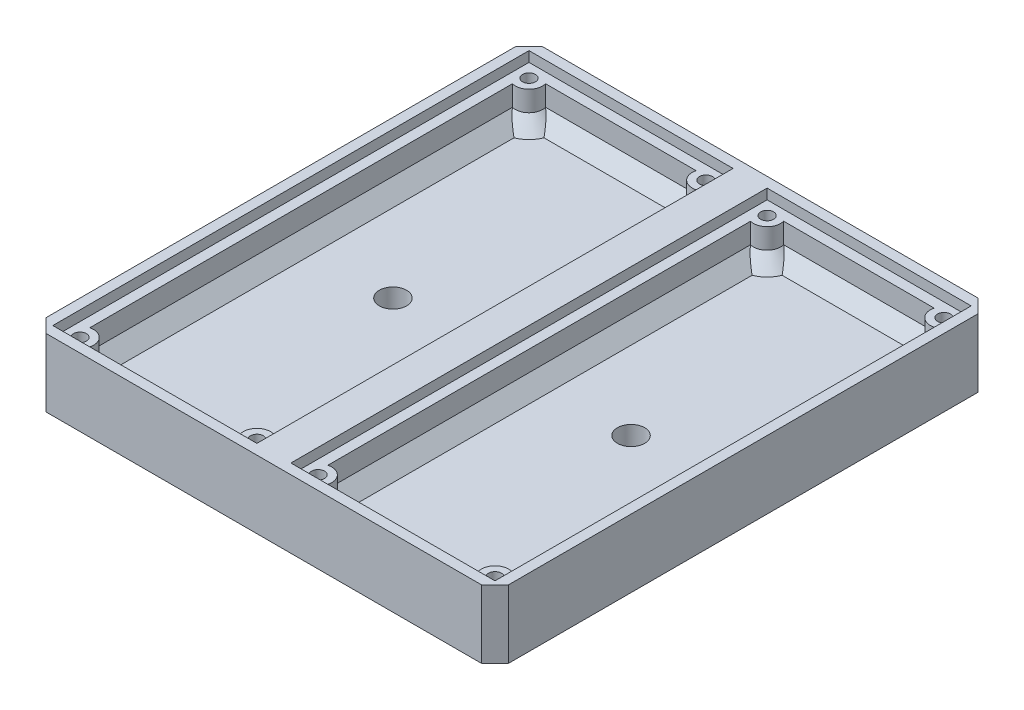
from build123d import *

# Parameters (mm, degrees)
SKETCH2_W           = 68
SKETCH2_H           = 73
SKETCH2_W_2         = 30
SKETCH2_H_2         = 70
BOSS_EXTRUDE1_DEPTH = 10
SKETCH2_3_W         = 30
SKETCH2_3_H         = 70
CUT_EXTRUDE2_DEPTH  = 1.5
SKETCH3_W           = 27
SKETCH3_H           = 67
CUT_EXTRUDE3_DEPTH  = 5
SKETCH4_R           = 2
BOSS_EXTRUDE2_DEPTH = 5
CUT_EXTRUDE4_START  = -5
SKETCH5_R           = 0.95
CUT_EXTRUDE4_DEPTH  = 5
CHAMFER1_SIZE       = 2
CHAMFER2_SIZE       = 2
SKETCH6_R           = 2
CUT_EXTRUDE5_DEPTH  = 4


with BuildPart() as part:
    # Sketch2 → Boss-Extrude1 (new body)
    # profile 1 of 3: a face of its own
    with BuildSketch(Plane(origin=(0, 0, 0), x_dir=(1, 0, 0), z_dir=(0, 1, 0))):
        Rectangle(SKETCH2_W, SKETCH2_H)
        with Locations((17.5, 0)):
            Rectangle(SKETCH2_W_2, SKETCH2_H_2, mode=Mode.SUBTRACT)
        with Locations((-17.5, 0)):
            Rectangle(SKETCH2_W_2, SKETCH2_H_2, mode=Mode.SUBTRACT)
    # profile 2 of 3: a face of its own
    with BuildSketch(Plane(origin=(0, 0, 0), x_dir=(1, 0, 0), z_dir=(0, 1, 0))):
        with Locations((17.5, 0)):
            Rectangle(SKETCH2_W_2, SKETCH2_H_2)
    # profile 3 of 3: a face of its own
    with BuildSketch(Plane(origin=(0, 0, 0), x_dir=(1, 0, 0), z_dir=(0, 1, 0))):
        with Locations((-17.5, 0)):
            Rectangle(SKETCH2_W_2, SKETCH2_H_2)
    extrude(amount=-BOSS_EXTRUDE1_DEPTH)

    # Sketch2<3> → Cut-Extrude2 (cut)
    with BuildSketch(Plane(origin=(0, 0, 0), x_dir=(1, 0, 0), z_dir=(0, 1, 0))):
        with Locations((-17.5, 0)):
            Rectangle(SKETCH2_3_W, SKETCH2_3_H)
        with Locations((17.5, 0)):
            Rectangle(SKETCH2_3_W, SKETCH2_3_H)
    extrude(amount=-CUT_EXTRUDE2_DEPTH, mode=Mode.SUBTRACT)

    # Sketch3 → Cut-Extrude3 (cut)
    with BuildSketch(Plane(origin=(0, -1.5, 0), x_dir=(1, 0, 0), z_dir=(0, 1, 0))):
        with Locations((-17.5, 0)):
            Rectangle(SKETCH3_W, SKETCH3_H)
        with Locations((17.5, 0)):
            Rectangle(SKETCH3_W, SKETCH3_H)
    extrude(amount=-CUT_EXTRUDE3_DEPTH, mode=Mode.SUBTRACT)

    # Sketch4 → Boss-Extrude2 (add)
    with BuildSketch(Plane(origin=(0, -6.5, 0), x_dir=(1, 0, 0), z_dir=(0, 1, 0))):
        with Locations((-30.5, 33)):
            Circle(SKETCH4_R)
        with Locations((-4.5, 33)):
            Circle(SKETCH4_R)
        with Locations((-4.5, -33)):
            Circle(SKETCH4_R)
        with Locations((-30.5, -33)):
            Circle(SKETCH4_R)
        with Locations((30.5, -33)):
            Circle(SKETCH4_R)
        with Locations((4.5, -33)):
            Circle(SKETCH4_R)
        with Locations((4.5, 33)):
            Circle(SKETCH4_R)
        with Locations((30.5, 33)):
            Circle(SKETCH4_R)
    extrude(amount=BOSS_EXTRUDE2_DEPTH)

    # Sketch5 → Cut-Extrude4 (cut)
    with BuildSketch(Plane(origin=(0, -1.5, 0), x_dir=(1, 0, 0), z_dir=(0, 1, 0)).offset(CUT_EXTRUDE4_START)):
        with Locations(Location((-30.5, 33, 0), (0, 0, 270))):
            Circle(SKETCH5_R)
        with Locations(Location((-4.5, 33, 0), (0, 0, 270))):
            Circle(SKETCH5_R)
        with Locations(Location((-4.5, -33, 0), (0, 0, 270))):
            Circle(SKETCH5_R)
        with Locations(Location((-30.5, -33, 0), (0, 0, 270))):
            Circle(SKETCH5_R)
        with Locations(Location((30.5, -33, 0), (0, 0, 270))):
            Circle(SKETCH5_R)
        with Locations(Location((4.5, -33, 0), (0, 0, 270))):
            Circle(SKETCH5_R)
        with Locations(Location((4.5, 33, 0), (0, 0, 270))):
            Circle(SKETCH5_R)
        with Locations(Location((30.5, 33, 0), (0, 0, 270))):
            Circle(SKETCH5_R)
    extrude(amount=CUT_EXTRUDE4_DEPTH, mode=Mode.SUBTRACT)

    # Chamfer1
    chamfer1_edges = [part.edges().sort_by_distance(p)[0] for p in [
        (-34, -5, 36.5),
        (-34, -5, -36.5),
        (34, -5, -36.5),
        (34, -5, 36.5),
    ]]
    chamfer(chamfer1_edges, length=CHAMFER1_SIZE)

    # Chamfer2
    chamfer2_edges = [part.edges().sort_by_distance(p)[0] for p in [
        (-4, -6.5, 0),
        (-5.914213562, -6.5, 31.585786438),
        (-17.5, -6.5, 33.5),
        (-29.085786438, -6.5, 31.585786438),
        (31, -6.5, 0),
        (29.085786438, -6.5, 31.585786438),
        (17.5, -6.5, 33.5),
        (5.914213562, -6.5, 31.585786438),
        (4, -6.5, 0),
        (5.914213562, -6.5, -31.585786438),
        (17.5, -6.5, -33.5),
        (29.085786438, -6.5, -31.585786438),
        (-31, -6.5, 0),
        (-29.085786438, -6.5, -31.585786438),
        (-17.5, -6.5, -33.5),
        (-5.914213562, -6.5, -31.585786438),
    ]]
    chamfer(chamfer2_edges, length=CHAMFER2_SIZE)

    # Sketch6 → Cut-Extrude5 (cut)
    with BuildSketch(Plane.XZ.offset(10)):
        with Locations(Location((-17.5, 0, 0), (0, 0, 270))):
            Circle(SKETCH6_R)
        with Locations(Location((17.5, 0, 0), (0, 0, 270))):
            Circle(SKETCH6_R)
    extrude(amount=-CUT_EXTRUDE5_DEPTH, mode=Mode.SUBTRACT)


solid = part.part
